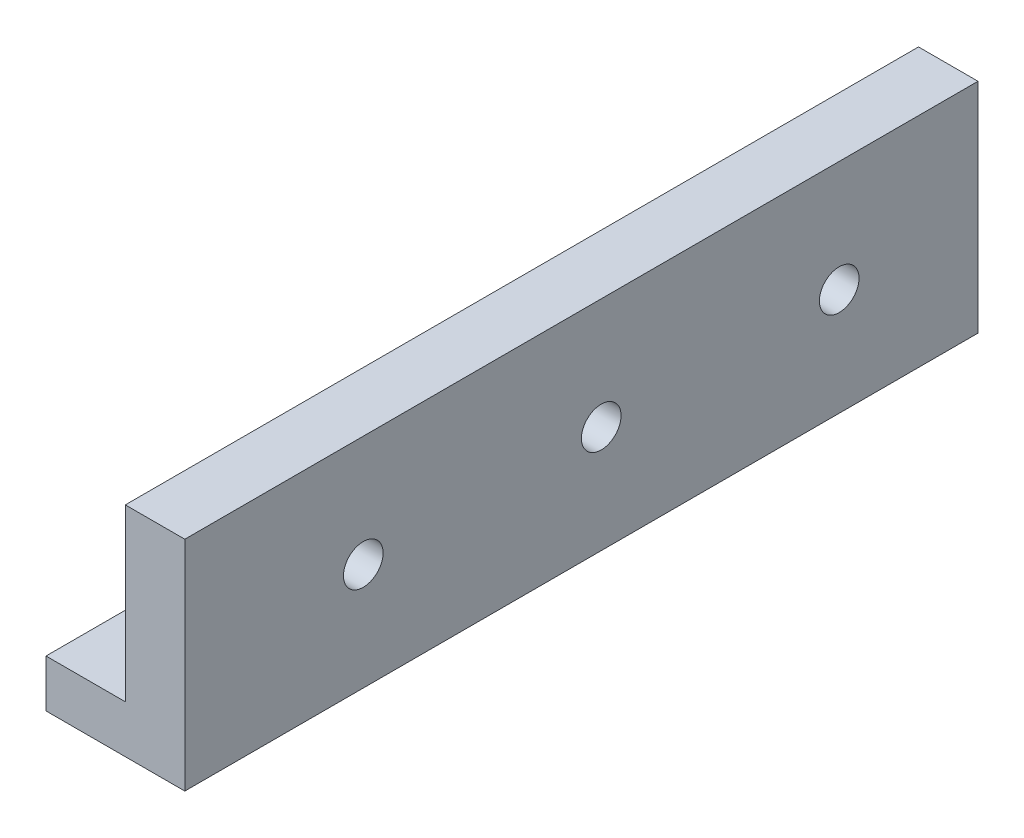
from build123d import *

# Parameters (mm, degrees)
EXTRUDE_1_DEPTH                 = 200
CUT_EXTRUDE_1_REACH             = 293.247
SKETCH_2_R                      = 5
CUT_EXTRUDE_1_DIRECTION_2_DEPTH = 292.246667899


with BuildPart() as part:
    # 草圖1 → 填料-伸長1 (new body)
    with BuildSketch(Plane.XY):
        Polygon((-5.019605957, 208.805223982), (-5.019605957, 165.805223982), (-25.019605957, 165.805223982), (-25.019605957, 153.805223982), (9.980394043, 153.805223982), (9.980394043, 208.805223982), align=None)
    extrude(amount=-EXTRUDE_1_DEPTH)

    # 草圖2 → 除料-伸長1 (cut, up to next)
    with BuildSketch(Plane(origin=(9.980394043, 0, 0), x_dir=(0, 0, -1), z_dir=(1, 0, 0)), mode=Mode.PRIVATE) as cut_extrude_1_sk1:
        with Locations(Location((45, 180.805223982, 0), (0, 0, 270))):
            Circle(SKETCH_2_R)
    cut_extrude_1_tool1 = extrude(cut_extrude_1_sk1.sketch, amount=-CUT_EXTRUDE_1_REACH, mode=Mode.PRIVATE) & part.part
    # 草圖2 → 除料-伸長1 (cut, up to next)
    with BuildSketch(Plane(origin=(9.980394043, 0, 0), x_dir=(0, 0, -1), z_dir=(1, 0, 0)), mode=Mode.PRIVATE) as cut_extrude_1_sk2:
        with Locations(Location((105, 180.805223982, 0), (0, 0, 270))):
            Circle(SKETCH_2_R)
    cut_extrude_1_tool2 = extrude(cut_extrude_1_sk2.sketch, amount=-CUT_EXTRUDE_1_REACH, mode=Mode.PRIVATE) & part.part
    # 草圖2 → 除料-伸長1 (cut, up to next)
    with BuildSketch(Plane(origin=(9.980394043, 0, 0), x_dir=(0, 0, -1), z_dir=(1, 0, 0)), mode=Mode.PRIVATE) as cut_extrude_1_sk3:
        with Locations(Location((165, 180.805223982, 0), (0, 0, 270))):
            Circle(SKETCH_2_R)
    cut_extrude_1_tool3 = extrude(cut_extrude_1_sk3.sketch, amount=-CUT_EXTRUDE_1_REACH, mode=Mode.PRIVATE) & part.part
    add(cut_extrude_1_tool1.solids().sort_by_distance((9.980394, 180.805224, -45))[0], mode=Mode.SUBTRACT)
    add(cut_extrude_1_tool2.solids().sort_by_distance((9.980394, 180.805224, -105))[0], mode=Mode.SUBTRACT)
    add(cut_extrude_1_tool3.solids().sort_by_distance((9.980394, 180.805224, -165))[0], mode=Mode.SUBTRACT)

    # 草圖2 → 除料-伸長1 direction 2 (cut)
    with BuildSketch(Plane(origin=(9.980394043, 0, 0), x_dir=(0, 0, -1), z_dir=(1, 0, 0))):
        with Locations(Location((45, 180.805223982, 0), (0, 0, 270))):
            Circle(SKETCH_2_R)
        with Locations(Location((105, 180.805223982, 0), (0, 0, 270))):
            Circle(SKETCH_2_R)
        with Locations(Location((165, 180.805223982, 0), (0, 0, 270))):
            Circle(SKETCH_2_R)
    extrude(amount=CUT_EXTRUDE_1_DIRECTION_2_DEPTH, mode=Mode.SUBTRACT)


solid = part.part
